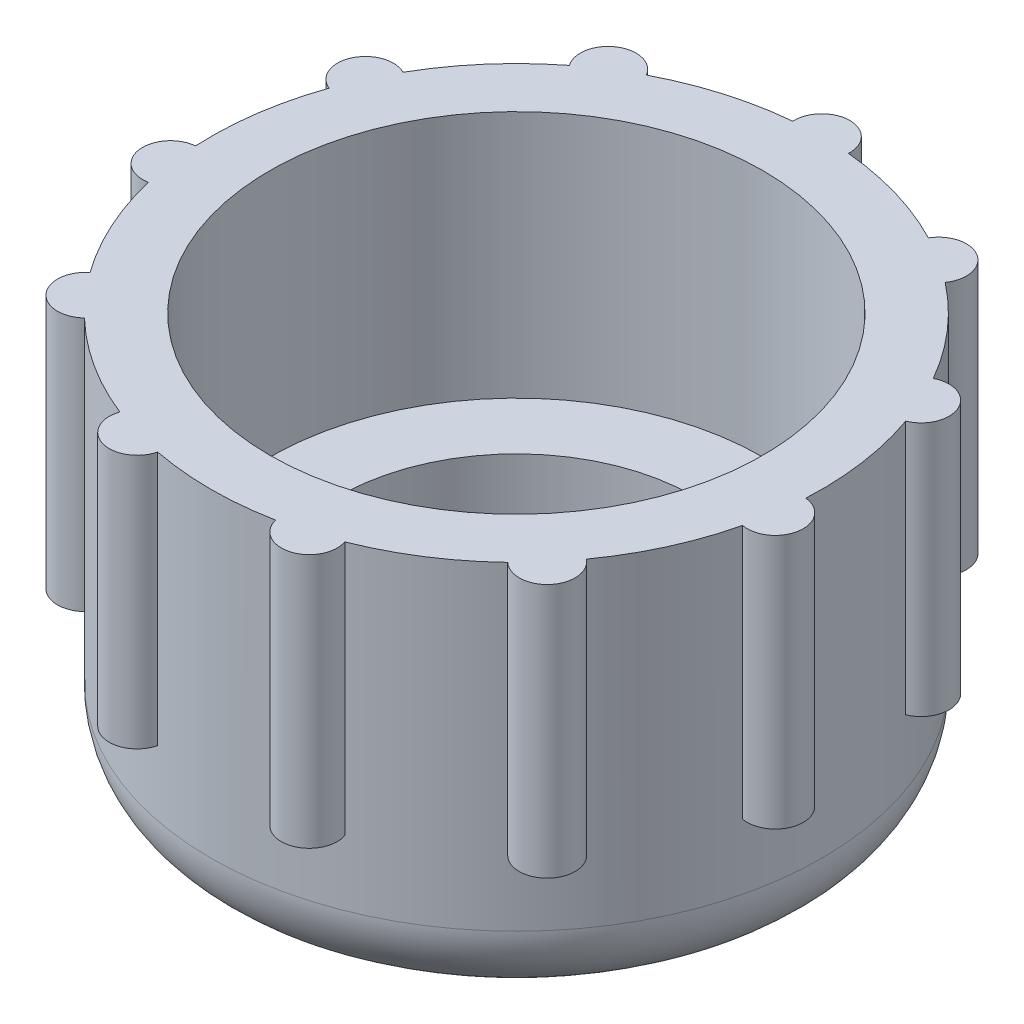
from build123d import *

# Parameters (mm, degrees)
SKETCH1_R           = 25.019
BOSS_EXTRUDE1_DEPTH = 32.512
SKETCH2_R           = 14.605
CUT_EXTRUDE1_DEPTH  = 32.512
BOSS_EXTRUDE2_START = -20.828
BOSS_EXTRUDE2_DEPTH = 20.828
CIRPATTERN1_COUNT   = 11
FILLET1_R           = 6.35
SKETCH4_R           = 20.193
CUT_EXTRUDE2_DEPTH  = 20.32


with BuildPart() as part:
    # Sketch1 → Boss-Extrude1 (new body)
    with BuildSketch(Plane(origin=(0, 0, 0), x_dir=(1, 0, 0), z_dir=(0, 1, 0))):
        with Locations(Location((0, 0, 0), (0, 0, 270))):
            Circle(SKETCH1_R)
    extrude(amount=BOSS_EXTRUDE1_DEPTH)

    # Sketch2 → Cut-Extrude1 (cut)
    with BuildSketch(Plane(origin=(0, 32.512, 0), x_dir=(1, 0, 0), z_dir=(0, 1, 0))):
        with Locations(Location((0, 0, 0), (0, 0, 270))):
            Circle(SKETCH2_R)
    extrude(amount=-CUT_EXTRUDE1_DEPTH, mode=Mode.SUBTRACT)

    # Sketch3 → Boss-Extrude2 (add)
    with BuildSketch(Plane(origin=(0, 32.512, 0), x_dir=(1, 0, 0), z_dir=(0, 1, 0)).offset(BOSS_EXTRUDE2_START)):
        with BuildLine():
            ThreePointArc((2.283613147, 24.914563452), (0, 25.019), (-2.283613147, 24.914563452))
            ThreePointArc((-2.283613147, 24.914563452), (0, 27.305), (2.283613147, 24.914563452))
        make_face()
    boss_extrude2 = extrude(amount=BOSS_EXTRUDE2_DEPTH)

    # CirPattern1: Boss-Extrude2 ×11 about axis
    cirpattern1_axis = Axis((0, 0, 0), (0, 1, 0))
    for i in range(1, CIRPATTERN1_COUNT):
        add(boss_extrude2.rotate(cirpattern1_axis, i * 360 / CIRPATTERN1_COUNT))

    # Fillet1
    fillet1_edges = [part.edges().sort_by_distance(p)[0] for p in [
        (0, 0, -25.019),
    ]]
    fillet(fillet1_edges, radius=FILLET1_R)

    # Sketch4 → Cut-Extrude2 (cut)
    with BuildSketch(Plane(origin=(0, 32.512, 0), x_dir=(1, 0, 0), z_dir=(0, 1, 0))):
        with Locations(Location((0, 0, 0), (0, 0, 270))):
            Circle(SKETCH4_R)
    extrude(amount=-CUT_EXTRUDE2_DEPTH, mode=Mode.SUBTRACT)


solid = part.part
